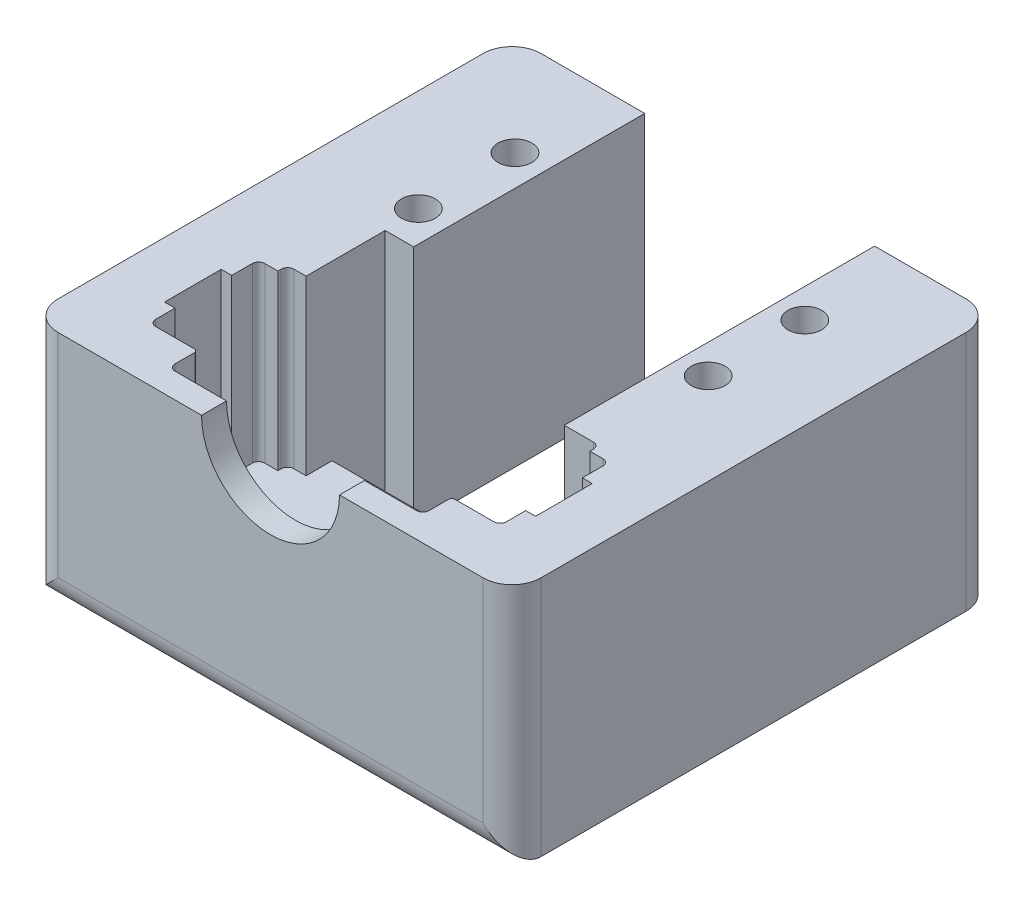
from build123d import *

# Parameters (mm, degrees)
EXTRUDE_1_DEPTH     = 25
CUT_EXTRUDE_1_DEPTH = 10
SKETCH_5_W          = 41.777974616
SKETCH_5_H          = 18.894782553
EXTRUDE_4_DEPTH     = 7.1
SKETCH_7_R          = 1.75
CUT_EXTRUDE_2_DEPTH = 44.301270189
FILLET_1_R          = 3


with BuildPart() as part:
    # 草图1 → 凸台-拉伸1 (new body)
    with BuildSketch(Plane(origin=(0, 0, 0), x_dir=(1, 0, 0), z_dir=(0, 1, 0))):
        with BuildLine():
            Line((-25, -25), (25, -25))
            Line((25, -25), (25, 25))
            Line((25, 25), (12.530461135, 25))
            Line((12.530461135, 25), (12.530461135, -7.120248206))
            Line((12.530461135, -7.120248206), (15.530461135, -7.120248206))
            ThreePointArc((15.530461135, -7.120248206), (15.990080543, -7.310628798), (16.180461135, -7.770248206))
            Line((16.180461135, -7.770248206), (16.180461135, -8.120248206))
            Line((16.180461135, -8.120248206), (17.530461135, -8.120248206))
            ThreePointArc((17.530461135, -8.120248206), (17.990080543, -8.310628798), (18.180461135, -8.770248206))
            Line((18.180461135, -8.770248206), (18.180461135, -10.898803743))
            Line((18.180461135, -10.898803743), (19.204850948, -10.898803743))
            Line((19.204850948, -10.898803743), (19.204850948, -16.766546625))
            Line((19.204850948, -16.766546625), (18.180461135, -16.766546625))
            Line((18.180461135, -16.766546625), (18.180461135, -18.770248206))
            ThreePointArc((18.180461135, -18.770248206), (17.990080543, -19.229867614), (17.530461135, -19.420248206))
            Line((17.530461135, -19.420248206), (13.530461135, -19.420248206))
            ThreePointArc((13.530461135, -19.420248206), (13.282973762, -19.522760833), (13.180461135, -19.770248206))
            Line((13.180461135, -19.770248206), (13.180461135, -21.770248206))
            ThreePointArc((13.180461135, -21.770248206), (12.990080543, -22.229867614), (12.530461135, -22.420248206))
            Line((12.530461135, -22.420248206), (-12.469538865, -22.420248206))
            ThreePointArc((-12.469538865, -22.420248206), (-12.929158272, -22.229867614), (-13.119538865, -21.770248206))
            Line((-13.119538865, -21.770248206), (-13.119538865, -19.770248206))
            ThreePointArc((-13.119538865, -19.770248206), (-13.222051491, -19.522760833), (-13.469538865, -19.420248206))
            Line((-13.469538865, -19.420248206), (-17.469538865, -19.420248206))
            ThreePointArc((-17.469538865, -19.420248206), (-17.929158272, -19.229867614), (-18.119538865, -18.770248206))
            Line((-18.119538865, -18.770248206), (-18.119538865, -16.766546625))
            Line((-18.119538865, -16.766546625), (-18.180461135, -16.766546625))
            Line((-18.180461135, -16.766546625), (-19.204850948, -16.766546625))
            Line((-19.204850948, -16.766546625), (-19.204850948, -10.898803743))
            Line((-19.204850948, -10.898803743), (-18.180461135, -10.898803743))
            Line((-18.180461135, -10.898803743), (-18.119538865, -10.898803743))
            Line((-18.119538865, -10.898803743), (-18.119538865, -8.770248206))
            ThreePointArc((-18.119538865, -8.770248206), (-17.929158272, -8.310628798), (-17.469538865, -8.120248206))
            Line((-17.469538865, -8.120248206), (-16.119538865, -8.120248206))
            Line((-16.119538865, -8.120248206), (-16.119538865, -7.770248206))
            ThreePointArc((-16.119538865, -7.770248206), (-15.929158272, -7.310628798), (-15.469538865, -7.120248206))
            Line((-15.469538865, -7.120248206), (-14.200297417, -7.120248206))
            Line((-14.200297417, -7.120248206), (-14.200297417, 1.071122011))
            Line((-14.200297417, 1.071122011), (-11.261897063, 1.071122011))
            Line((-11.261897063, 1.071122011), (-11.261897063, 25))
            Line((-11.261897063, 25), (-25, 25))
            Line((-25, 25), (-25, -25))
        make_face()
    extrude(amount=EXTRUDE_1_DEPTH)

    # 草图2 → 切除-拉伸1 (cut)
    with BuildSketch(Plane.XY.offset(25)):
        with BuildLine():
            Line((7.139013901, 25), (-7.139013901, 25))
            ThreePointArc((-7.139013901, 25), (0, 17.860986099), (7.139013901, 25))
        make_face()
    extrude(amount=-CUT_EXTRUDE_1_DEPTH, mode=Mode.SUBTRACT)

    # 草图5 → 凸台-拉伸4 (add)
    with BuildSketch(Plane.XZ):
        with Locations((0, 13.870801672)):
            Rectangle(SKETCH_5_W, SKETCH_5_H)
    extrude(amount=-EXTRUDE_4_DEPTH)

    # 草图7 → 切除-拉伸2 (cut, through all)
    with BuildSketch(Plane(origin=(0, 25, 0), x_dir=(1, 0, 0), z_dir=(0, 1, 0))):
        with Locations(Location((15.550997874, 4.753034163, 0), (0, 0, 270))):
            Circle(SKETCH_7_R)
        with Locations(Location((15.550997874, 14.753034163, 0), (0, 0, 270))):
            Circle(SKETCH_7_R)
        with Locations(Location((-14.449002126, 4.753034163, 0), (0, 0, 270))):
            Circle(SKETCH_7_R)
        with Locations(Location((-14.449002126, 14.753034163, 0), (0, 0, 270))):
            Circle(SKETCH_7_R)
    extrude(amount=-CUT_EXTRUDE_2_DEPTH, mode=Mode.SUBTRACT)

    # 圆角1
    fillet_1_edges = [part.edges().sort_by_distance(p)[0] for p in [
        (-0.834918141, 0, 4.423410395),
        (0, 0, 25),
        (25, 12.5, -25),
        (25, 12.5, 25),
        (-25, 12.5, 25),
        (-25, 12.5, -25),
    ]]
    fillet(fillet_1_edges, radius=FILLET_1_R)


solid = part.part
